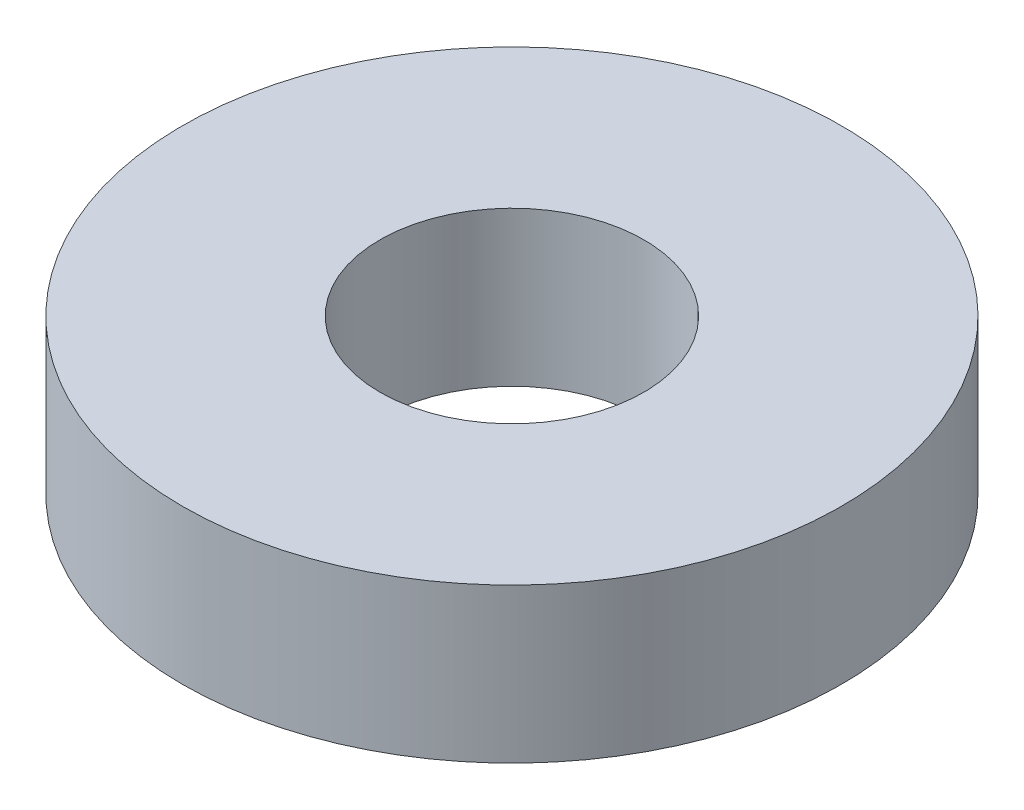
from build123d import *

# Parameters (mm, degrees)
SKETCH1_R           = 3.9624
BOSS_EXTRUDE1_DEPTH = 1.8542
SKETCH5_R           = 1.5875
CUT_EXTRUDE1_DEPTH  = 6.902481271


with BuildPart() as part:
    # Sketch1 → Boss-Extrude1 (new body)
    with BuildSketch(Plane(origin=(0, 0, 0), x_dir=(1, 0, 0), z_dir=(0, 1, 0))):
        with Locations(Location((0, 0, 0), (0, 0, 270))):
            Circle(SKETCH1_R)
    extrude(amount=BOSS_EXTRUDE1_DEPTH)

    # Sketch5 → Cut-Extrude1 (cut, through all)
    with BuildSketch(Plane(origin=(0, 1.8542, 0), x_dir=(-1, 0, 0), z_dir=(0, 1, 0))):
        with Locations(Location((0, 0, 0), (0, 0, 90))):
            Circle(SKETCH5_R)
    extrude(amount=-CUT_EXTRUDE1_DEPTH, mode=Mode.SUBTRACT)


solid = part.part
